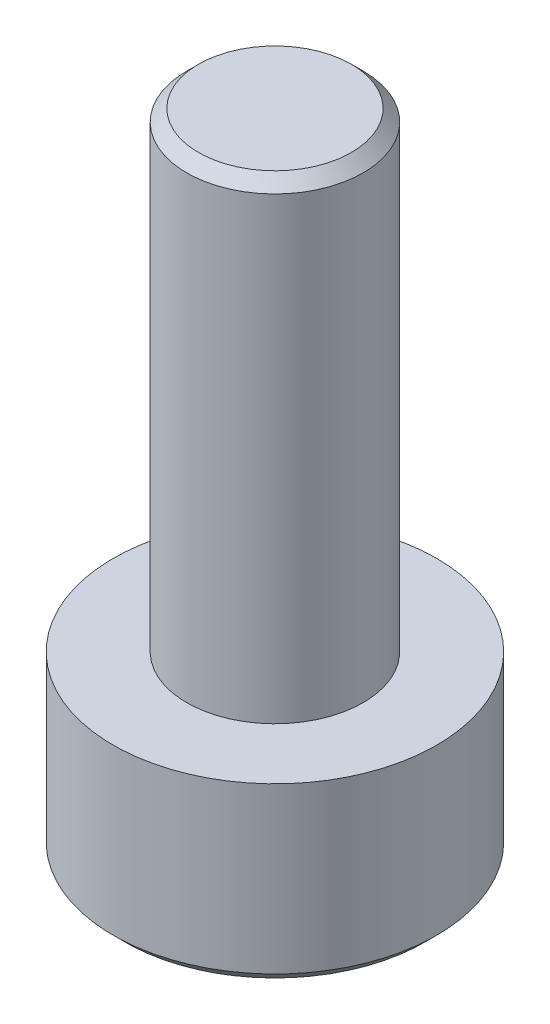
from build123d import *

# Parameters (mm, degrees)
SIMPLIFIED_START                    = -3
SIMPLIFIED_NOMINAL_HEX_SOCKET_DEPTH = 1.5


with BuildPart() as part:
    # Reconstructed nominal axial profile → Native revolved geometry (revolve)
    with BuildSketch(Plane.XY, mode=Mode.PRIVATE) as native_revolved_geometry_sk:
        Polygon((0, -3), (2.55, -3), (2.75, -2.8), (2.75, 0), (1.5, 0), (1.5, 7.8), (1.3, 8), (0, 8), align=None)
    revolve(native_revolved_geometry_sk.sketch.rotate(Axis((0, -500, 0), (0, 1, 0)), 90), axis=Axis((0, -500, 0), (0, 1, 0)))

    # Sketch2 → Simplified nominal hex socket (cut)
    with BuildSketch(Plane(origin=(0, 0, 0), x_dir=(1, 0, 0), z_dir=(0, 1, 0)).offset(SIMPLIFIED_START)):
        Polygon((1.443375673, 0), (0.721687836, -1.25), (-0.721687836, -1.25), (-1.443375673, 0), (-0.721687836, 1.25), (0.721687836, 1.25), align=None)
    extrude(amount=SIMPLIFIED_NOMINAL_HEX_SOCKET_DEPTH, mode=Mode.SUBTRACT)


solid = part.part
